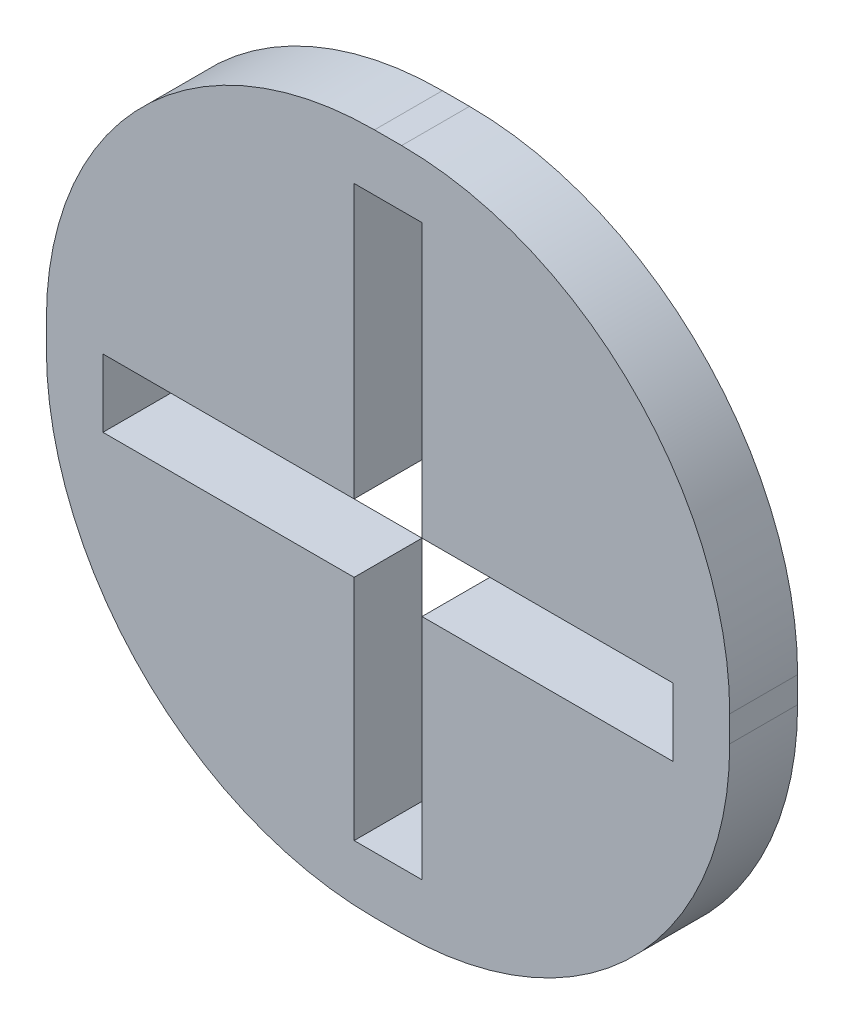
from build123d import *

# Parameters (mm, degrees)
SALIENTE_EXTRUIR1_DEPTH = 3


with BuildPart() as part:
    # Croquis1 → Saliente-Extruir1 (new body)
    with BuildSketch(Plane.XY):
        with BuildLine():
            Line((-0.6, -15.075), (0.6, -15.075))
            ThreePointArc((0.6, -15.075), (10.853048327, -10.828048327), (15.1, -0.575))
            Line((15.1, -0.575), (15.1, 0.575))
            ThreePointArc((15.1, 0.575), (10.853048327, 10.828048327), (0.6, 15.075))
            Line((0.6, 15.075), (-0.6, 15.075))
            ThreePointArc((-0.6, 15.075), (-10.853048327, 10.828048327), (-15.1, 0.575))
            Line((-15.1, 0.575), (-15.1, -0.575))
            ThreePointArc((-15.1, -0.575), (-10.853048327, -10.828048327), (-0.6, -15.075))
        make_face()
        Polygon((-12.6, -2.5), (-12.6, 0.5), (-1.5, 0.5), (-1.5, 12.575), (1.5, 12.575), (1.5, 0.5), (12.6, 0.5), (12.6, -2.5), (1.5, -2.5), (1.5, -12.575), (-1.5, -12.575), (-1.5, -2.5), align=None, mode=Mode.SUBTRACT)
    extrude(amount=SALIENTE_EXTRUIR1_DEPTH)


solid = part.part
